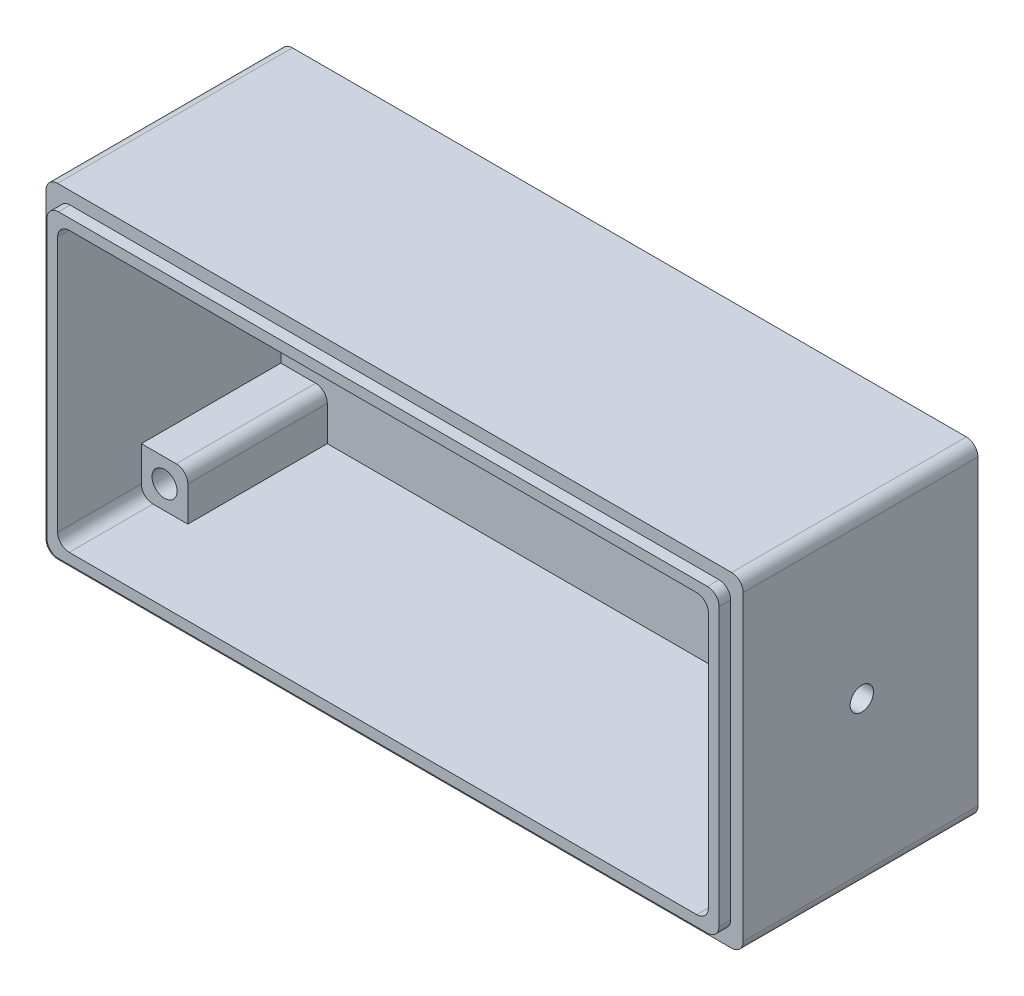
from build123d import *

# Parameters (mm, degrees)
SKETCH1_W                                  = 95.25
SKETCH1_H                                  = 44.45
BOSS_EXTRUDE1_DEPTH                        = 3.175
SKETCH2_W                                  = 95.25
SKETCH2_H                                  = 44.45
SKETCH2_W_2                                = 88.9
SKETCH2_H_2                                = 38.1
BOSS_EXTRUDE2_DEPTH                        = 28.9
SKETCH3_R                                  = 1.7
CUT_EXTRUDE1_DEPTH                         = 62.570259663
CUT_EXTRUDE2_DEPTH                         = 1.7145
FILLET1_R                                  = 1.5875
BOSS_EXTRUDE3_START                        = 1.5875
BOSS_EXTRUDE3_DEPTH                        = 1.5875
SKETCH6_R                                  = 1.715
BOSS_EXTRUDE4_DEPTH                        = 19.05
SKETCH7_R                                  = 1.715
CUT_EXTRUDE3_DEPTH                         = 58.061737399
CUT_EXTRUDE4_DEPTH                         = 1.7145
MIRROR3_AT_THE_SECOND_PLANE_COPY_1_SKETC_R = 1.715
MIRROR3_AT_THE_SECOND_PLANE_COPY_1_DEPTH   = 19.05
MIRROR3_AT_THE_SECOND_PLANE_COPY_2_SKETC_R = 1.715
MIRROR3_AT_THE_SECOND_PLANE_COPY_2_DEPTH   = 58.061737399
MIRROR3_AT_THE_SECOND_PLANE_COPY_3_DEPTH   = 1.7145
SKETCH9_R                                  = 1.59
CUT_EXTRUDE5_DEPTH                         = 101.523231923


with BuildPart() as part:
    # Sketch1 → Boss-Extrude1 (new body)
    with BuildSketch(Plane.XY):
        Rectangle(SKETCH1_W, SKETCH1_H)
    extrude(amount=BOSS_EXTRUDE1_DEPTH)

    # Sketch2 → Boss-Extrude2 (add)
    with BuildSketch(Plane.XY.offset(3.175)):
        Rectangle(SKETCH2_W, SKETCH2_H)
        Rectangle(SKETCH2_W_2, SKETCH2_H_2, mode=Mode.SUBTRACT)
    extrude(amount=BOSS_EXTRUDE2_DEPTH)

    # Sketch3 → Cut-Extrude1 (cut, through all)
    with BuildSketch(Plane(origin=(0, 0, 0), x_dir=(-1, 0, 0), z_dir=(0, 0, -1))):
        with Locations((27.051, 0)):
            Circle(SKETCH3_R)
    cut_extrude1 = extrude(amount=-CUT_EXTRUDE1_DEPTH, mode=Mode.SUBTRACT)

    # Mirror1: Cut-Extrude1 across plane
    add(cut_extrude1.mirror(Plane(origin=(0, 0, 0), x_dir=(0, 0, 1), z_dir=(1, 0, 0))), mode=Mode.SUBTRACT)

    # Sketch4 → Cut-Extrude2 (cut)
    with BuildSketch(Plane(origin=(0, 0, 0), x_dir=(-1, 0, 0), z_dir=(0, 0, -1))):
        Polygon((30.497781106, 0), (28.774390553, 2.984999999), (25.327609447, 2.984999999), (23.604218894, 0), (25.327609447, -2.984999999), (28.774390553, -2.984999999), align=None)
    cut_extrude2 = extrude(amount=-CUT_EXTRUDE2_DEPTH, mode=Mode.SUBTRACT)

    # Mirror2: Cut-Extrude2 across plane
    add(cut_extrude2.mirror(Plane(origin=(0, 0, 0), x_dir=(0, 0, 1), z_dir=(1, 0, 0))), mode=Mode.SUBTRACT)

    # Fillet1
    fillet1_edges = [part.edges().sort_by_distance(p)[0] for p in [
        (44.45, 19.05, 17.625),
        (-44.45, 19.05, 17.625),
        (-44.45, -19.05, 17.625),
        (44.45, -19.05, 17.625),
        (47.625, -22.225, 16.0375),
        (-47.625, -22.225, 16.0375),
        (-47.625, 22.225, 16.0375),
        (47.625, 22.225, 16.0375),
    ]]
    fillet(fillet1_edges, radius=FILLET1_R)

    # Sketch5 → Boss-Extrude3 (add)
    with BuildSketch(Plane.XY.offset(32.075).offset(BOSS_EXTRUDE3_START)):
        with BuildLine():
            Line((-44.323, -20.5105), (44.323, -20.5105))
            ThreePointArc((44.323, -20.5105), (45.445532015, -20.045532015), (45.9105, -18.923))
            Line((45.9105, -18.923), (45.9105, 18.923))
            ThreePointArc((45.9105, 18.923), (45.445532015, 20.045532015), (44.323, 20.5105))
            Line((44.323, 20.5105), (-44.323, 20.5105))
            ThreePointArc((-44.323, 20.5105), (-45.445532015, 20.045532015), (-45.9105, 18.923))
            Line((-45.9105, 18.923), (-45.9105, -18.923))
            ThreePointArc((-45.9105, -18.923), (-45.445532015, -20.045532015), (-44.323, -20.5105))
        make_face()
        with BuildLine():
            Line((44.45, -17.4625), (44.45, 17.4625))
            ThreePointArc((44.45, 17.4625), (43.985032015, 18.585032015), (42.8625, 19.05))
            Line((42.8625, 19.05), (-42.8625, 19.05))
            ThreePointArc((-42.8625, 19.05), (-43.985032015, 18.585032015), (-44.45, 17.4625))
            Line((-44.45, 17.4625), (-44.45, -17.4625))
            ThreePointArc((-44.45, -17.4625), (-43.985032015, -18.585032015), (-42.8625, -19.05))
            Line((-42.8625, -19.05), (42.8625, -19.05))
            ThreePointArc((42.8625, -19.05), (43.985032015, -18.585032015), (44.45, -17.4625))
        make_face(mode=Mode.SUBTRACT)
    extrude(amount=-BOSS_EXTRUDE3_DEPTH)

    # Sketch6 → Boss-Extrude4 (add)
    with BuildSketch(Plane.XY.offset(3.175)):
        with BuildLine():
            Line((-44.45, 19.05), (-38.1, 19.05))
            Line((-38.1, 19.05), (-38.1, 14.2875))
            ThreePointArc((-38.1, 14.2875), (-38.564967985, 13.164967985), (-39.6875, 12.7))
            Line((-39.6875, 12.7), (-44.45, 12.7))
            Line((-44.45, 12.7), (-44.45, 19.05))
        make_face()
        with Locations(Location((-41.275, 15.875, 0), (0, 0, 180))):
            Circle(SKETCH6_R, mode=Mode.SUBTRACT)
    boss_extrude4 = extrude(amount=BOSS_EXTRUDE4_DEPTH)

    # Sketch7 → Cut-Extrude3 (cut, through all)
    with BuildSketch(Plane.XY.offset(22.225)):
        with Locations(Location((-41.275, 15.875, 0), (0, 0, 180))):
            Circle(SKETCH7_R)
    cut_extrude3 = extrude(amount=-CUT_EXTRUDE3_DEPTH, mode=Mode.SUBTRACT)

    # Sketch8 → Cut-Extrude4 (cut)
    with BuildSketch(Plane(origin=(0, 0, 0), x_dir=(-1, 0, 0), z_dir=(0, 0, -1))):
        Polygon((37.828218893, 15.875), (39.551609446, 12.89), (42.998390554, 12.89), (44.721781107, 15.875), (42.998390554, 18.86), (39.551609446, 18.86), align=None)
    cut_extrude4 = extrude(amount=-CUT_EXTRUDE4_DEPTH, mode=Mode.SUBTRACT)

    # Mirror3: Boss-Extrude4, Cut-Extrude3, Cut-Extrude4 across plane
    add(boss_extrude4.mirror(Plane(origin=(0, 0, 0), x_dir=(0, 0, 1), z_dir=(1, 0, 0))))
    add(cut_extrude3.mirror(Plane(origin=(0, 0, 0), x_dir=(0, 0, 1), z_dir=(1, 0, 0))), mode=Mode.SUBTRACT)
    add(cut_extrude4.mirror(Plane(origin=(0, 0, 0), x_dir=(0, 0, 1), z_dir=(1, 0, 0))), mode=Mode.SUBTRACT)

    # Mirror3 at the second plane: Boss-Extrude4, Cut-Extrude3, Cut-Extrude4 across plane
    add(boss_extrude4.mirror(Plane.ZX))
    add(cut_extrude3.mirror(Plane.ZX), mode=Mode.SUBTRACT)
    add(cut_extrude4.mirror(Plane.ZX), mode=Mode.SUBTRACT)

    # Mirror3 at the second plane copy 1 sketc → Mirror3 at the second plane copy 1 (add)
    with BuildSketch(Plane(origin=(0, 0, 3.175), x_dir=(-1, 0, 0), z_dir=(0, 0, 1))):
        with BuildLine():
            Line((-44.45, 19.05), (-38.1, 19.05))
            Line((-38.1, 19.05), (-38.1, 14.2875))
            ThreePointArc((-38.1, 14.2875), (-38.564967985, 13.164967985), (-39.6875, 12.7))
            Line((-39.6875, 12.7), (-44.45, 12.7))
            Line((-44.45, 12.7), (-44.45, 19.05))
        make_face()
        with Locations(Location((-41.275, 15.875, 0), (0, 0, 180))):
            Circle(MIRROR3_AT_THE_SECOND_PLANE_COPY_1_SKETC_R, mode=Mode.SUBTRACT)
    extrude(amount=MIRROR3_AT_THE_SECOND_PLANE_COPY_1_DEPTH)

    # Mirror3 at the second plane copy 2 sketc → Mirror3 at the second plane copy 2 (cut, through all)
    with BuildSketch(Plane(origin=(0, 0, 22.225), x_dir=(-1, 0, 0), z_dir=(0, 0, 1))):
        with Locations(Location((-41.275, 15.875, 0), (0, 0, 180))):
            Circle(MIRROR3_AT_THE_SECOND_PLANE_COPY_2_SKETC_R)
    extrude(amount=-MIRROR3_AT_THE_SECOND_PLANE_COPY_2_DEPTH, mode=Mode.SUBTRACT)

    # Mirror3 at the second plane copy 3 sketc → Mirror3 at the second plane copy 3 (cut)
    with BuildSketch(Plane(origin=(0, 0, 0), x_dir=(1, 0, 0), z_dir=(0, 0, -1))):
        Polygon((37.828218893, 15.875), (39.551609446, 12.89), (42.998390554, 12.89), (44.721781107, 15.875), (42.998390554, 18.86), (39.551609446, 18.86), align=None)
    extrude(amount=-MIRROR3_AT_THE_SECOND_PLANE_COPY_3_DEPTH, mode=Mode.SUBTRACT)

    # Sketch9 → Cut-Extrude5 (cut, through all)
    with BuildSketch(Plane.ZY.offset(-44.45)):
        with Locations((15.875, 0)):
            Circle(SKETCH9_R)
    extrude(amount=-CUT_EXTRUDE5_DEPTH, mode=Mode.SUBTRACT)


solid = part.part
